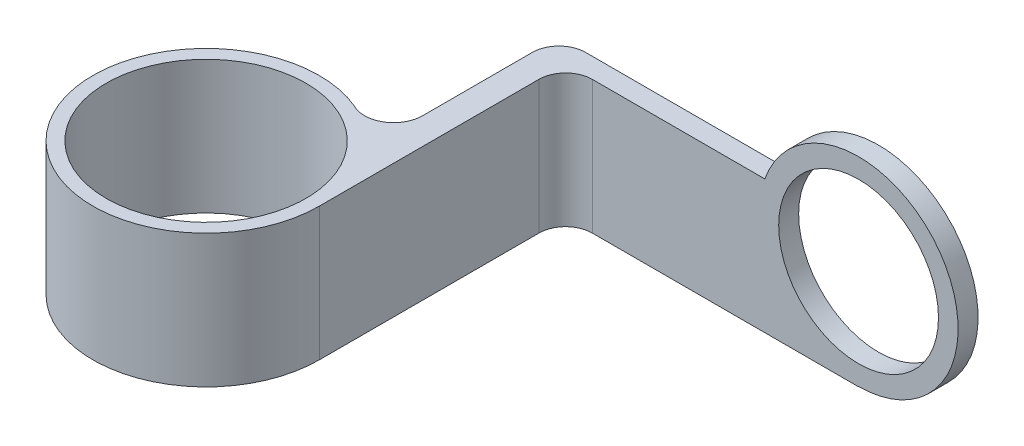
from build123d import *
from build123d.topology import SkipClean

# Parameters (mm, degrees)
SKETCH1_R           = 15
BOSS_EXTRUDE2_DEPTH = 20
CUT_EXTRUDE2_DEPTH  = 21
BOSS_EXTRUDE3_DEPTH = 3


with BuildPart() as part:
    # Sketch1 → Boss-Extrude2 (new body)
    # profile 1 of 2: a face of its own
    with BuildSketch(Plane(origin=(0, 0, 0), x_dir=(1, 0, 0), z_dir=(0, 1, 0))):
        with BuildLine():
            ThreePointArc((-50.780177481, 15.676092064), (-71.513924264, -9.412408123), (-40.357421401, 0))
            ThreePointArc((-40.357421401, 0), (-43.025497107, 9.143081868), (-50.192238582, 15.416230251))
            ThreePointArc((-50.192238582, 15.416230251), (-50.490994878, 15.535330889), (-50.780177481, 15.676092064))
        make_face()
        with Locations(Location((-57.357421401, 0, 0), (0, 0, 270))):
            Circle(SKETCH1_R, mode=Mode.SUBTRACT)
    # profile 2 of 2: a face of its own
    with BuildSketch(Plane(origin=(0, 0, 0), x_dir=(1, 0, 0), z_dir=(0, 1, 0))):
        with BuildLine():
            Line((-40.357421401, 0), (-40.357421401, 33))
            ThreePointArc((-40.357421401, 33), (-39.185848526, 35.828427125), (-36.357421401, 37))
            Line((-36.357421401, 37), (3.642578599, 37))
            Line((3.642578599, 37), (3.642578599, 40))
            Line((3.642578599, 40), (-40.357421401, 40))
            ThreePointArc((-40.357421401, 40), (-43.185848526, 38.828427125), (-44.357421401, 36))
            Line((-44.357421401, 36), (-44.357421401, 19.501688617))
            ThreePointArc((-44.357421401, 19.501688617), (-46.219952281, 15.952391985), (-50.192238582, 15.416230251))
            ThreePointArc((-50.192238582, 15.416230251), (-43.025497107, 9.143081868), (-40.357421401, 0))
        make_face()
    extrude(amount=BOSS_EXTRUDE2_DEPTH)

    # Sketch3 → Cut-Extrude2 (cut)
    with BuildSketch(Plane(origin=(0, 0, -40), x_dir=(-1, 0, 0), z_dir=(0, 0, -1))):
        with BuildLine():
            Line((-3.642578599, 20), (-3.642578599, 3))
            ThreePointArc((-3.642578599, 3), (4.842702775, 6.514718626), (8.357421401, 15))
            ThreePointArc((8.357421401, 15), (8.081425525, 17.558852734), (7.266133516, 20))
            Line((7.266133516, 20), (-3.642578599, 20))
        make_face()
        with BuildLine():
            ThreePointArc((7.266133516, 20), (-13.742083537, 21.480740698), (-3.642578599, 3))
            Line((-3.642578599, 3), (-3.642578599, 20))
            Line((-3.642578599, 20), (7.266133516, 20))
        make_face()
    extrude(amount=-CUT_EXTRUDE2_DEPTH, mode=Mode.SUBTRACT)

    # Sketch4 → Boss-Extrude3 (add)
    with SkipClean():  # the faces are left unmerged after this step: merging them gives an invalid solid
        with BuildSketch(Plane(origin=(0, 0, -40), x_dir=(-1, 0, 0), z_dir=(0, 0, -1))):
            with BuildLine():
                Line((-3.642578599, 0.051873716), (-3.642578599, 3))
                ThreePointArc((-3.642578599, 3), (-13.742083537, 21.480740698), (7.266133516, 20))
                Line((7.266133516, 20), (10.444524701, 20))
                ThreePointArc((10.444524701, 20), (-15.852965792, 23.622814157), (-3.642578599, 0.051873716))
            make_face()
        extrude(amount=-BOSS_EXTRUDE3_DEPTH)


solid = part.part
